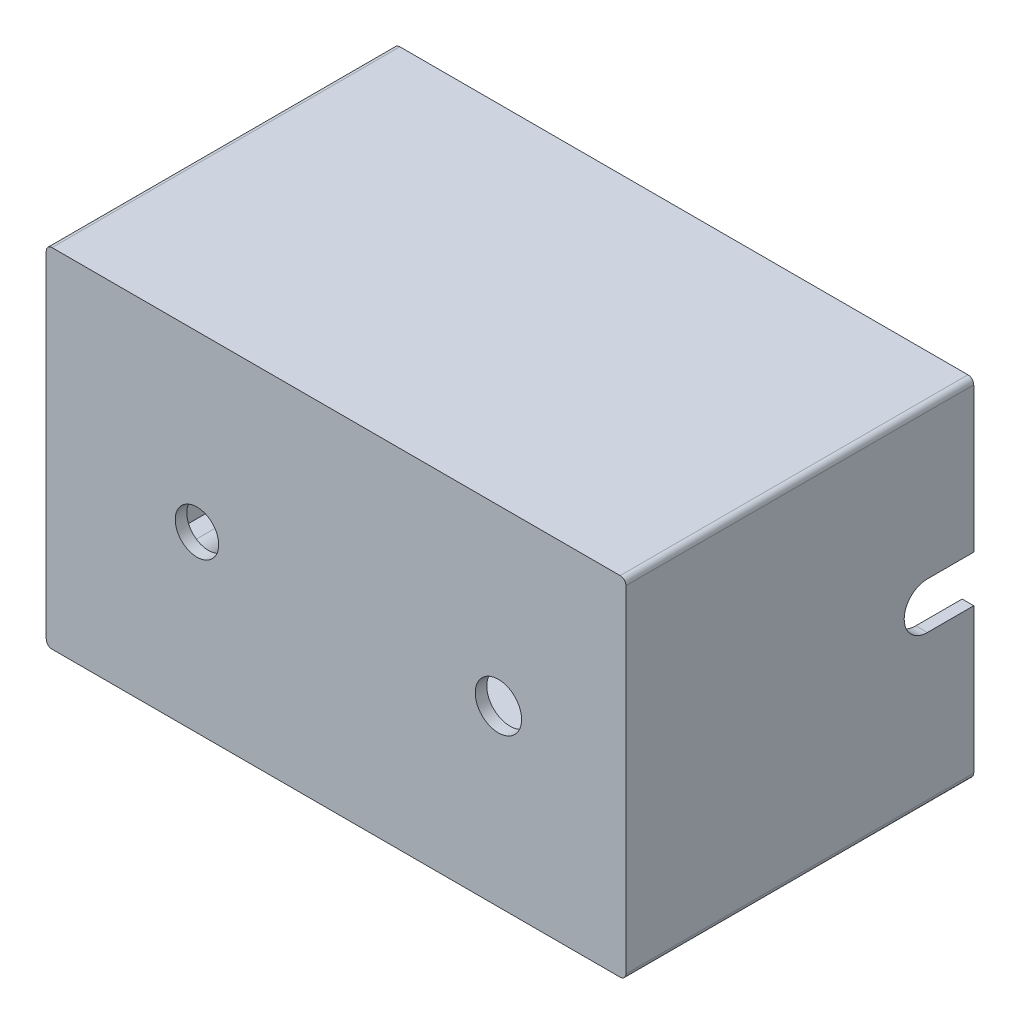
from build123d import *

# Parameters (mm, degrees)
SKETCH1_W               = 100
SKETCH1_H               = 60
BOSS_EXTRUDE1_DEPTH     = 60
SHELL1_T                = -2
SKETCH2_R               = 3.75
SKETCH2_R_2             = 4
CUT_EXTRUDE1_DEPTH      = 60
SKETCH3_R               = 1.35
BOSS_EXTRUDE4_DEPTH     = 58
MIRROR2_COPY_1_SKETCH_R = 1.35
MIRROR2_COPY_1_DEPTH    = 58
FILLET1_R               = 1
CUT_EXTRUDE2_DEPTH      = 121.415945788


with BuildPart() as part:
    # Sketch1 → Boss-Extrude1 (new body)
    with BuildSketch(Plane.XY):
        Rectangle(SKETCH1_W, SKETCH1_H)
    extrude(amount=BOSS_EXTRUDE1_DEPTH)

    # Shell1
    shell1_openings = [part.faces().sort_by_distance(p)[0] for p in [
        (0, 0, 0),
    ]]
    offset(amount=SHELL1_T, openings=shell1_openings, kind=Kind.INTERSECTION)

    # Sketch2 → Cut-Extrude1 (cut)
    with BuildSketch(Plane.XY.offset(60)):
        with Locations((-24, 0)):
            Circle(SKETCH2_R)
        with Locations((28, 0)):
            Circle(SKETCH2_R_2)
    extrude(amount=-CUT_EXTRUDE1_DEPTH, mode=Mode.SUBTRACT)

    # Sketch3 → Boss-Extrude4 (add)
    with BuildSketch(Plane(origin=(0, 0, 58), x_dir=(-1, 0, 0), z_dir=(0, 0, -1))):
        with BuildLine():
            Line((-42, 25), (-42, 28))
            Line((-42, 28), (-48, 28))
            Line((-48, 28), (-48, 22))
            Line((-48, 22), (-45, 22))
            ThreePointArc((-45, 22), (-42.878679656, 22.878679656), (-42, 25))
        make_face()
        with Locations(Location((-45, 25, 0), (0, 0, 180))):
            Circle(SKETCH3_R, mode=Mode.SUBTRACT)
    boss_extrude4 = extrude(amount=BOSS_EXTRUDE4_DEPTH)

    # Mirror1: Boss-Extrude4 across plane
    add(boss_extrude4.mirror(Plane(origin=(0, 0, 0), x_dir=(0, 0, 1), z_dir=(1, 0, 0))))

    # Mirror2: Boss-Extrude4 across plane
    add(boss_extrude4.mirror(Plane.ZX))

    # Mirror2 copy 1 sketch → Mirror2 copy 1 (add)
    with BuildSketch(Plane(origin=(0, 0, 58), x_dir=(1, 0, 0), z_dir=(0, 0, -1))):
        with BuildLine():
            Line((-42, 25), (-42, 28))
            Line((-42, 28), (-48, 28))
            Line((-48, 28), (-48, 22))
            Line((-48, 22), (-45, 22))
            ThreePointArc((-45, 22), (-42.878679656, 22.878679656), (-42, 25))
        make_face()
        with Locations(Location((-45, 25, 0), (0, 0, 180))):
            Circle(MIRROR2_COPY_1_SKETCH_R, mode=Mode.SUBTRACT)
    extrude(amount=MIRROR2_COPY_1_DEPTH)

    # Fillet1
    fillet1_edges = [part.edges().sort_by_distance(p)[0] for p in [
        (-50, 30, 30),
        (50, 30, 30),
        (50, -30, 30),
        (-50, -30, 30),
    ]]
    fillet(fillet1_edges, radius=FILLET1_R)

    # Sketch4 → Cut-Extrude2 (cut, through all)
    with BuildSketch(Plane(origin=(50, 0, 0), x_dir=(0, 0, -1), z_dir=(1, 0, 0))):
        with BuildLine():
            Line((-8, -4), (0, -4))
            Line((0, -4), (0, 4))
            Line((0, 4), (-8, 4))
            ThreePointArc((-8, 4), (-12, 0), (-8, -4))
        make_face()
    extrude(amount=-CUT_EXTRUDE2_DEPTH, mode=Mode.SUBTRACT)


solid = part.part
